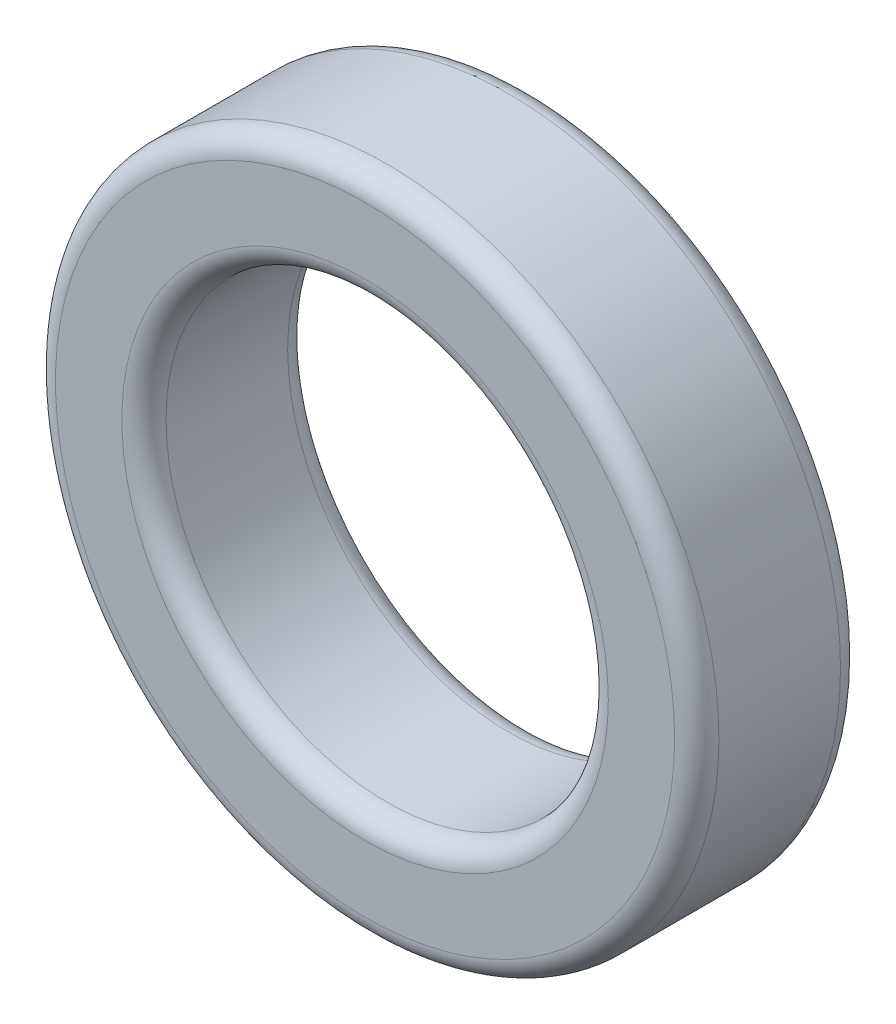
from build123d import *

# Parameters (mm, degrees)
SKETCH2_R           = 7.62
SKETCH2_R_2         = 5.08
BOSS_EXTRUDE1_DEPTH = 3.81
FILLET1_R           = 0.508
FILLET2_R           = 0.508
FILLET3_R           = 0.508
FILLET4_R           = 0.508


with BuildPart() as part:
    # Sketch2 → Boss-Extrude1 (new body)
    with BuildSketch(Plane.XY):
        with Locations(Location((0, 0, 0), (0, 0, 180))):
            Circle(SKETCH2_R)
        with Locations(Location((0, 0, 0), (0, 0, 180))):
            Circle(SKETCH2_R_2, mode=Mode.SUBTRACT)
    extrude(amount=BOSS_EXTRUDE1_DEPTH)

    # Fillet1
    fillet1_edges = [part.edges().sort_by_distance(p)[0] for p in [
        (5.08, 0, 3.81),
    ]]
    fillet(fillet1_edges, radius=FILLET1_R)

    # Fillet2
    fillet2_edges = [part.edges().sort_by_distance(p)[0] for p in [
        (5.08, 0, 0),
    ]]
    fillet(fillet2_edges, radius=FILLET2_R)

    # Fillet3
    fillet3_edges = [part.edges().sort_by_distance(p)[0] for p in [
        (7.62, 0, 0),
    ]]
    fillet(fillet3_edges, radius=FILLET3_R)

    # Fillet4
    fillet4_edges = [part.edges().sort_by_distance(p)[0] for p in [
        (7.62, 0, 3.81),
    ]]
    fillet(fillet4_edges, radius=FILLET4_R)


solid = part.part
